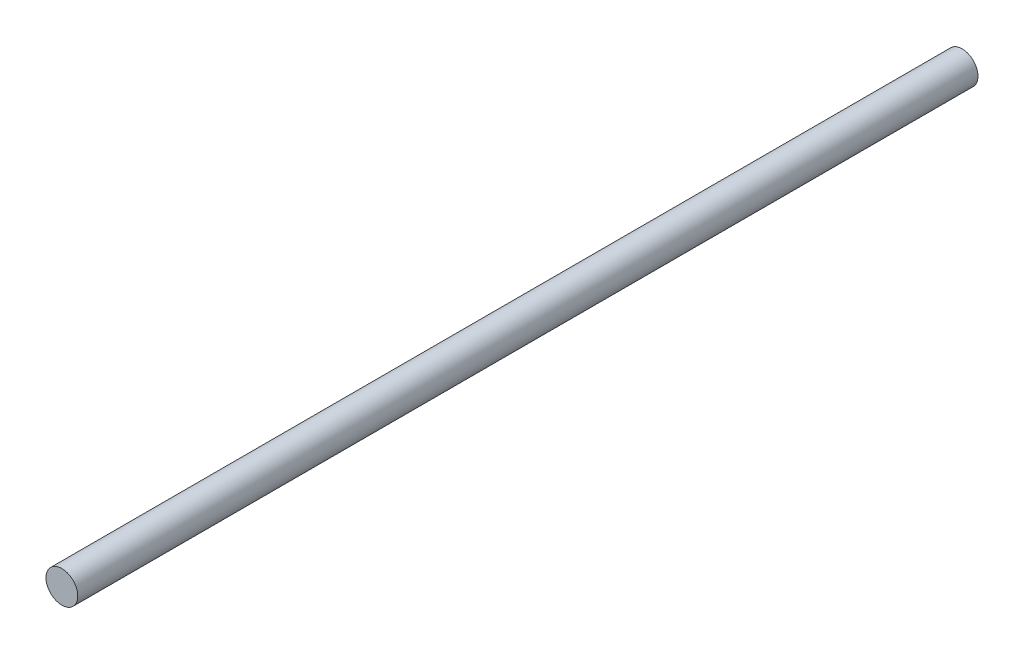
from build123d import *

# Parameters (mm, degrees)
ESQUISSE1_R        = 3
BOSS_EXTRU_1_DEPTH = 170


with BuildPart() as part:
    # Esquisse1 → Boss.-Extru.1 (new body)
    with BuildSketch(Plane.XY):
        Circle(ESQUISSE1_R)
    extrude(amount=BOSS_EXTRU_1_DEPTH)


solid = part.part
